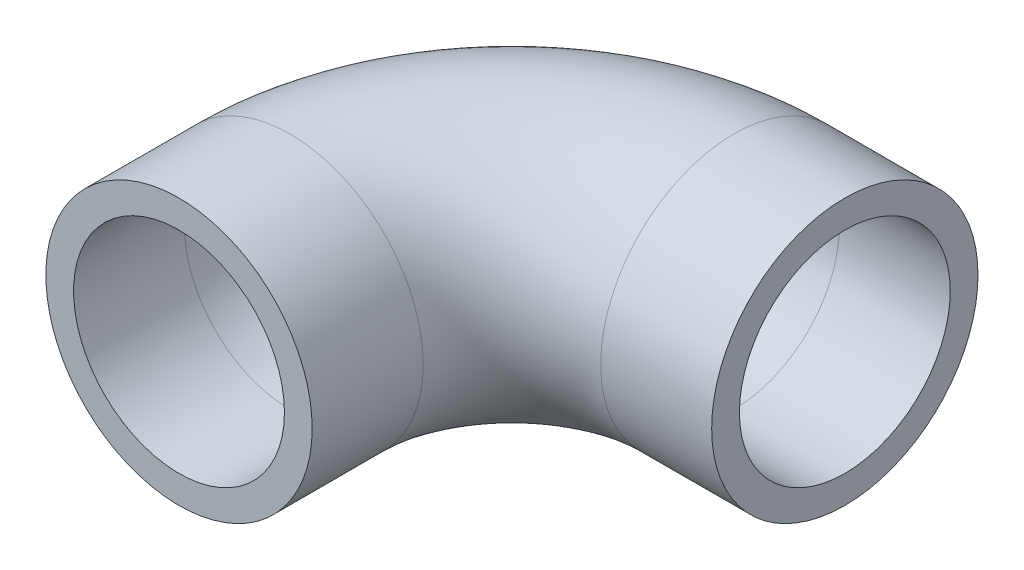
from build123d import *

# Parameters (mm, degrees)
SKETCH2_R   = 30.48
SKETCH2_R_2 = 24.13


with BuildPart() as part:
    # Sweep1: sweep along a path in Sketch1
    with BuildLine(Plane(origin=(0, 0, 0), x_dir=(1, 0, 0), z_dir=(0, 1, 0))) as sweep1_path:
        Line((0, 0), (0, 25.4))
        ThreePointArc((0, 25.4), (14.878975516, 61.321024484), (50.8, 76.2))
        Line((50.8, 76.2), (76.2, 76.2))
    # Sketch2 → Sweep1 (sweep)
    with BuildSketch(Plane.XY):
        Circle(SKETCH2_R)
        Circle(SKETCH2_R_2, mode=Mode.SUBTRACT)
    sweep(path=sweep1_path.line)


solid = part.part
